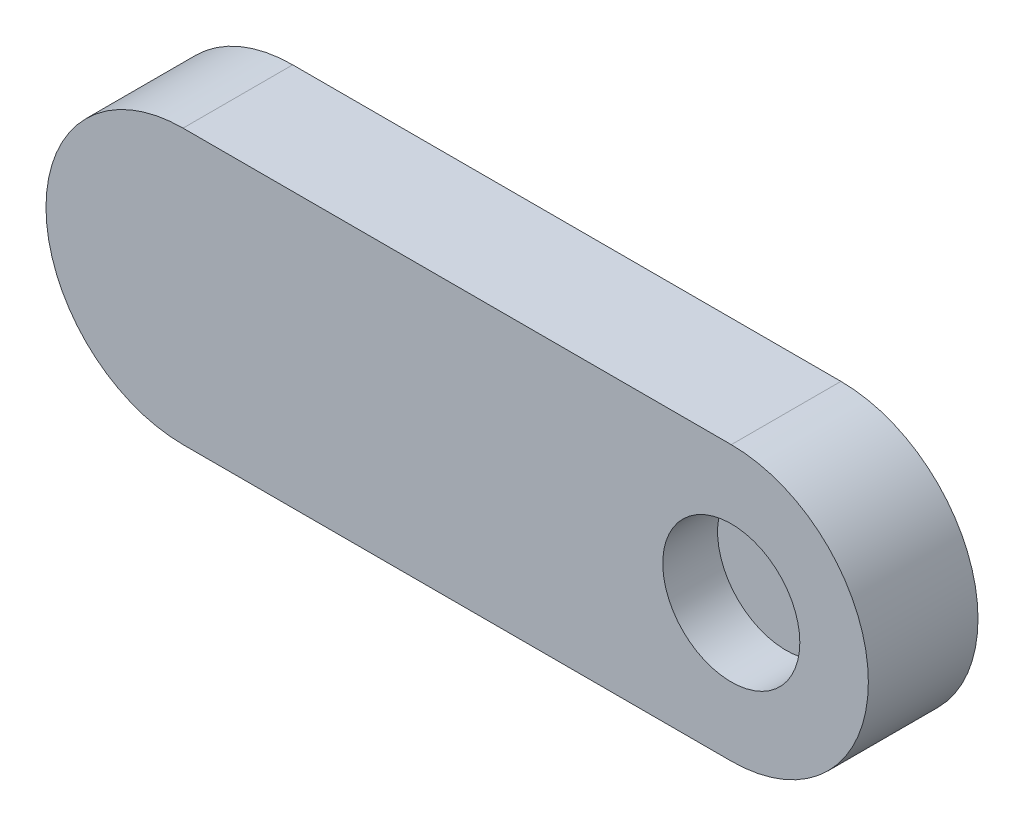
from build123d import *

# Parameters (mm, degrees)
EXTRUDE_1_DEPTH     = 40
SKETCH_2_R          = 25
CUT_EXTRUDE_1_DEPTH = 20
SKETCH_3_R          = 25
CUT_EXTRUDE_2_DEPTH = 20


with BuildPart() as part:
    # 草图1 → 凸台-拉伸1 (new body)
    with BuildSketch(Plane.XY):
        with BuildLine():
            Line((0, 50), (200, 50))
            ThreePointArc((200, 50), (250, 0), (200, -50))
            Line((200, -50), (0, -50))
            ThreePointArc((0, -50), (-50, 0), (0, 50))
        make_face()
    extrude(amount=EXTRUDE_1_DEPTH)

    # 草图2 → 切除-拉伸1 (cut)
    with BuildSketch(Plane(origin=(0, 0, 0), x_dir=(-1, 0, 0), z_dir=(0, 0, -1))):
        Circle(SKETCH_2_R)
    extrude(amount=-CUT_EXTRUDE_1_DEPTH, mode=Mode.SUBTRACT)

    # 草图3 → 切除-拉伸2 (cut)
    with BuildSketch(Plane.XY.offset(40)):
        with Locations((200, 0)):
            Circle(SKETCH_3_R)
    extrude(amount=-CUT_EXTRUDE_2_DEPTH, mode=Mode.SUBTRACT)


solid = part.part
